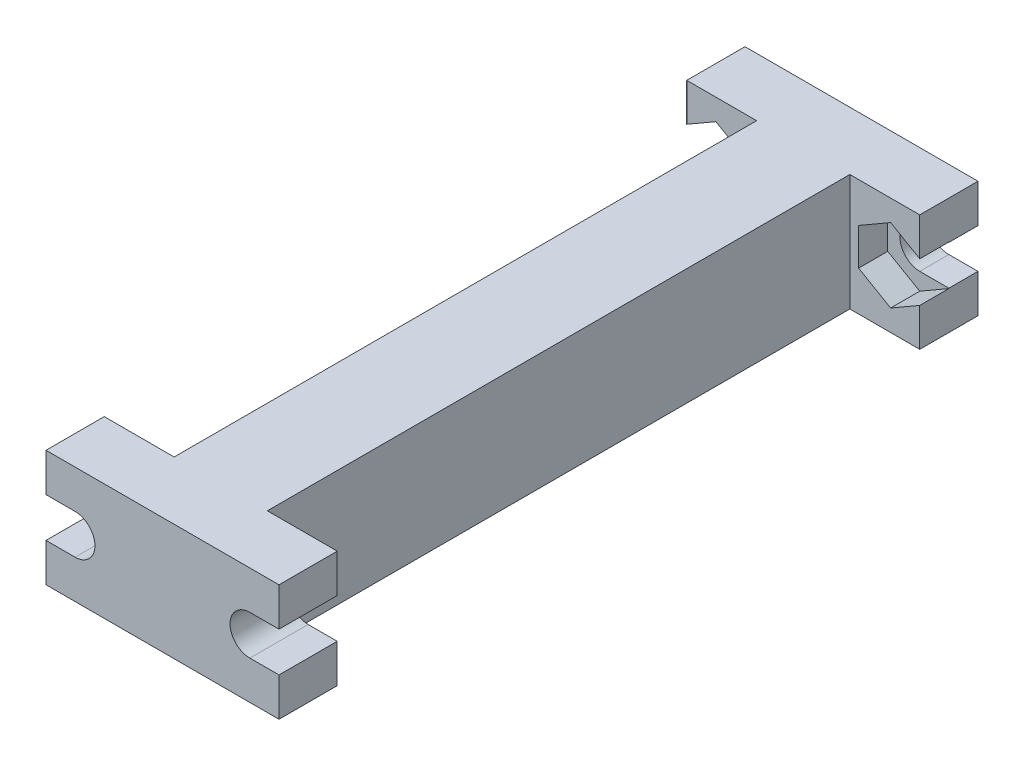
from build123d import *

# Parameters (mm, degrees)
SKETCH1_W           = 20
SKETCH1_H           = 10
BOSS_EXTRUDE1_DEPTH = 5
SKETCH2_W           = 8
SKETCH2_H           = 10
BOSS_EXTRUDE2_DEPTH = 50
CUT_EXTRUDE1_DEPTH  = 10
BOSS_EXTRUDE3_START = 5
BOSS_EXTRUDE3_DEPTH = 5
CUT_EXTRUDE2_DEPTH  = 2.5


with BuildPart() as part:
    # Sketch1 → Boss-Extrude1 (new body)
    with BuildSketch(Plane.XY):
        Rectangle(SKETCH1_W, SKETCH1_H)
    extrude(amount=BOSS_EXTRUDE1_DEPTH)

    # Sketch2 → Boss-Extrude2 (add)
    with BuildSketch(Plane.XY.offset(5)):
        Rectangle(SKETCH2_W, SKETCH2_H)
    extrude(amount=BOSS_EXTRUDE2_DEPTH)

    # Sketch3 → Cut-Extrude1 (cut)
    with BuildSketch(Plane.XY.offset(5)):
        with BuildLine():
            Line((-7.5, 1.7), (-10, 1.7))
            Line((-10, 1.7), (-10, -1.7))
            Line((-10, -1.7), (-7.5, -1.7))
            ThreePointArc((-7.5, -1.7), (-5.8, 0), (-7.5, 1.7))
        make_face()
        with BuildLine():
            Line((7.5, 1.7), (10, 1.7))
            Line((10, 1.7), (10, -1.7))
            Line((10, -1.7), (7.5, -1.7))
            ThreePointArc((7.5, -1.7), (5.8, 0), (7.5, 1.7))
        make_face()
    extrude(amount=-CUT_EXTRUDE1_DEPTH, mode=Mode.SUBTRACT)

    # Sketch4 → Boss-Extrude3 (add)
    with BuildSketch(Plane.XY.offset(55).offset(BOSS_EXTRUDE3_START)):
        with BuildLine():
            Line((-7.5, 1.7), (-10, 1.7))
            Line((-10, 1.7), (-10, 5))
            Line((-10, 5), (10, 5))
            Line((10, 5), (10, 1.7))
            Line((10, 1.7), (7.5, 1.7))
            ThreePointArc((7.5, 1.7), (5.8, 0), (7.5, -1.7))
            Line((7.5, -1.7), (10, -1.7))
            Line((10, -1.7), (10, -5))
            Line((10, -5), (-10, -5))
            Line((-10, -5), (-10, -1.7))
            Line((-10, -1.7), (-7.5, -1.7))
            ThreePointArc((-7.5, -1.7), (-5.8, 0), (-7.5, 1.7))
        make_face()
    extrude(amount=-BOSS_EXTRUDE3_DEPTH)

    # Sketch5 → Cut-Extrude2 (cut)
    with BuildSketch(Plane.XY.offset(5)):
        Polygon((-4.75, 1.58771324), (-4.75, -1.58771324), (-7.5, -3.175426481), (-10.25, -1.58771324), (-10.25, 1.58771324), (-7.5, 3.175426481), align=None)
    cut_extrude2 = extrude(amount=-CUT_EXTRUDE2_DEPTH, mode=Mode.SUBTRACT)

    # Mirror1: Cut-Extrude2 across plane
    add(cut_extrude2.mirror(Plane(origin=(0, 0, 0), x_dir=(0, 0, 1), z_dir=(1, 0, 0))), mode=Mode.SUBTRACT)


solid = part.part
